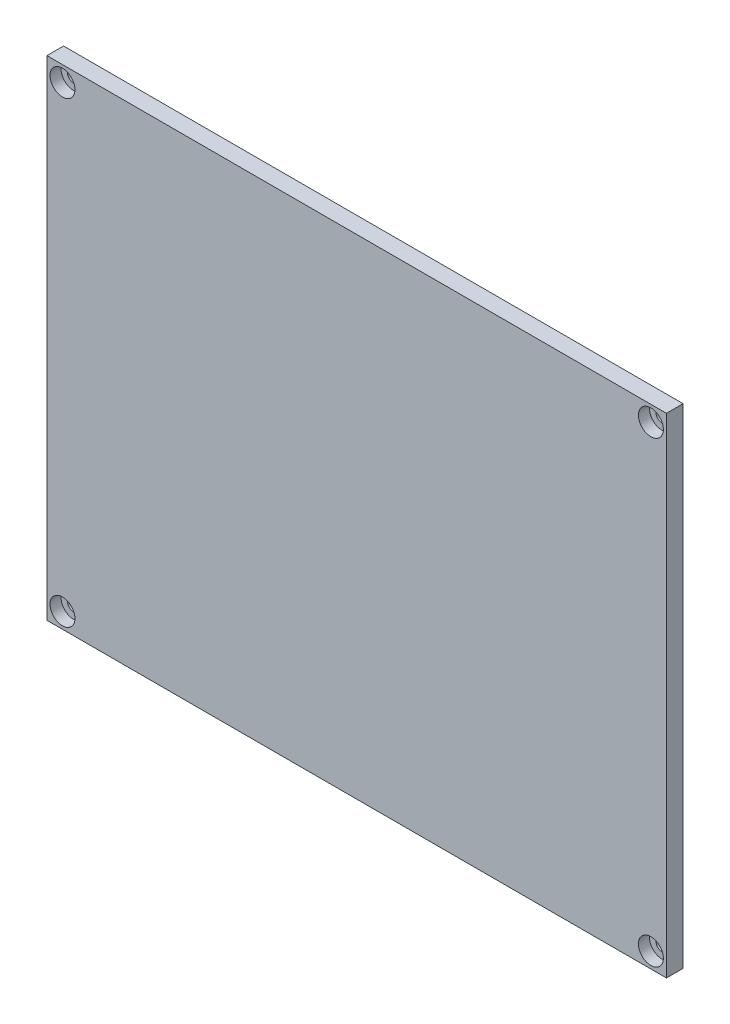
from build123d import *

# Parameters (mm, degrees)
SKETCH1_W           = 112
SKETCH1_H           = 88.5
BOSS_EXTRUDE1_DEPTH = 3
SKETCH2_R           = 1.1
CUT_EXTRUDE1_DEPTH  = 72.435722856
SKETCH3_W           = 112
SKETCH3_H           = 88.5
SKETCH3_W_2         = 111.6
SKETCH3_H_2         = 88.1
CUT_EXTRUDE2_DEPTH  = 72.435722856
SKETCH4_R           = 2.25
CUT_EXTRUDE3_DEPTH  = 2


with BuildPart() as part:
    # Sketch1 → Boss-Extrude1 (new body)
    with BuildSketch(Plane.XY):
        Rectangle(SKETCH1_W, SKETCH1_H)
    extrude(amount=BOSS_EXTRUDE1_DEPTH)

    # Sketch2 → Cut-Extrude1 (cut, through all)
    with BuildSketch(Plane.XY.offset(3)):
        with Locations((-53, 41.25)):
            Circle(SKETCH2_R)
        with Locations((53, 41.25)):
            Circle(SKETCH2_R)
        with Locations((53, -41.25)):
            Circle(SKETCH2_R)
        with Locations((-53, -41.25)):
            Circle(SKETCH2_R)
    extrude(amount=-CUT_EXTRUDE1_DEPTH, mode=Mode.SUBTRACT)

    # Sketch3 → Cut-Extrude2 (cut, through all)
    with BuildSketch(Plane.XY.offset(3)):
        Rectangle(SKETCH3_W, SKETCH3_H)
        Rectangle(SKETCH3_W_2, SKETCH3_H_2, mode=Mode.SUBTRACT)
    extrude(amount=-CUT_EXTRUDE2_DEPTH, mode=Mode.SUBTRACT)

    # Sketch4 → Cut-Extrude3 (cut)
    with BuildSketch(Plane.XY.offset(3)):
        with Locations((-53, 41.25)):
            Circle(SKETCH4_R)
        with Locations((53, 41.25)):
            Circle(SKETCH4_R)
        with Locations((53, -41.25)):
            Circle(SKETCH4_R)
        with Locations((-53, -41.25)):
            Circle(SKETCH4_R)
    extrude(amount=-CUT_EXTRUDE3_DEPTH, mode=Mode.SUBTRACT)


solid = part.part
